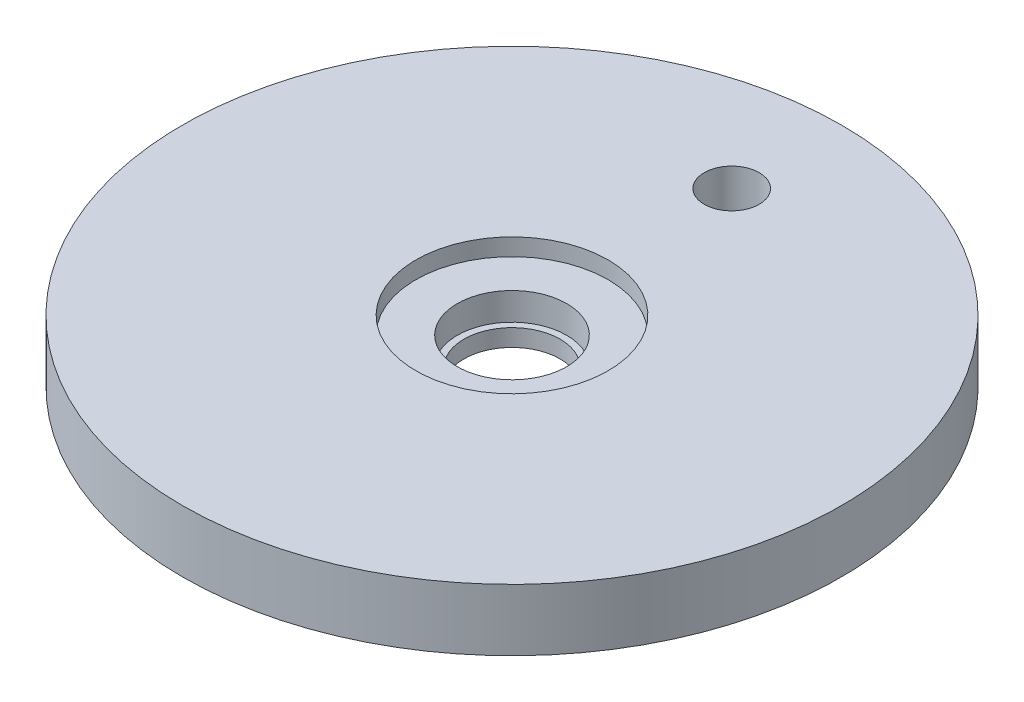
from build123d import *

# Parameters (mm, degrees)
SKETCH2_R          = 3.175
CUT_EXTRUDE1_DEPTH = 55.353041903


with BuildPart() as part:
    # Sketch1 → Revolve1 (revolve)
    with BuildSketch(Plane.XY):
        Polygon((11.1125, 3.571875), (38.1, 3.571875), (38.1, -3.571875), (11.1125, -3.571875), (11.1125, -2.162669552), (7.9375, -2.162669552), (7.9375, -3.571875), (5.55625, -3.571875), (5.55625, -1.5875), (6.3246, -1.5875), (6.3246, 1.5875), (11.1125, 1.5875), align=None)
    revolve(axis=Axis((0, 0, 0), (0, 1, 0)))

    # Sketch2 → Cut-Extrude1 (cut, through all)
    with BuildSketch(Plane(origin=(0, 3.571875, 0), x_dir=(1, 0, 0), z_dir=(0, 1, 0))):
        with Locations((0, 25.4)):
            Circle(SKETCH2_R)
    extrude(amount=-CUT_EXTRUDE1_DEPTH, mode=Mode.SUBTRACT)


solid = part.part
